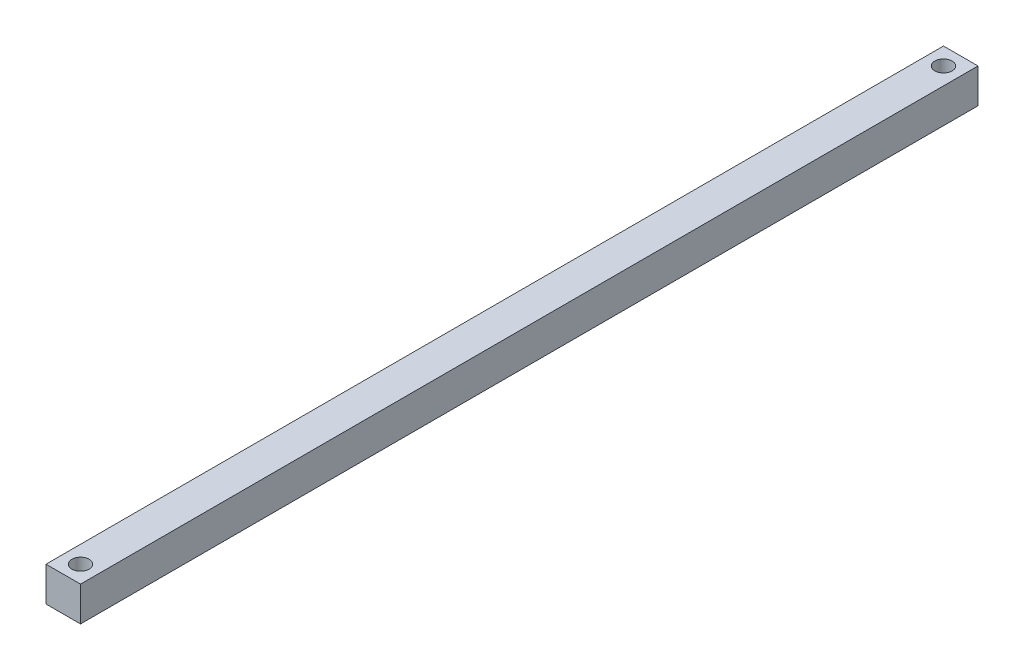
from build123d import *

# Parameters (mm, degrees)
ESQUISSE2_W             = 10
ESQUISSE2_H             = 260
BOSS_EXTRU_1_DEPTH      = 10
ESQUISSE3_R             = 2.5
ENL_V_MAT_EXTRU_1_DEPTH = 10


with BuildPart() as part:
    # Esquisse2 → Boss.-Extru.1 (new body)
    with BuildSketch(Plane(origin=(0, 0, 0), x_dir=(1, 0, 0), z_dir=(0, 1, 0))):
        with Locations((-5, 130)):
            Rectangle(ESQUISSE2_W, ESQUISSE2_H)
    extrude(amount=BOSS_EXTRU_1_DEPTH)

    # Esquisse3 → Enlèv. mat.-Extru.1 (cut)
    with BuildSketch(Plane(origin=(0, 10, 0), x_dir=(1, 0, 0), z_dir=(0, 1, 0))):
        with Locations(Location((-5, 255, 0), (0, 0, 270))):
            Circle(ESQUISSE3_R)
        with Locations(Location((-5, 5, 0), (0, 0, 270))):
            Circle(ESQUISSE3_R)
    extrude(amount=-ENL_V_MAT_EXTRU_1_DEPTH, mode=Mode.SUBTRACT)


solid = part.part
